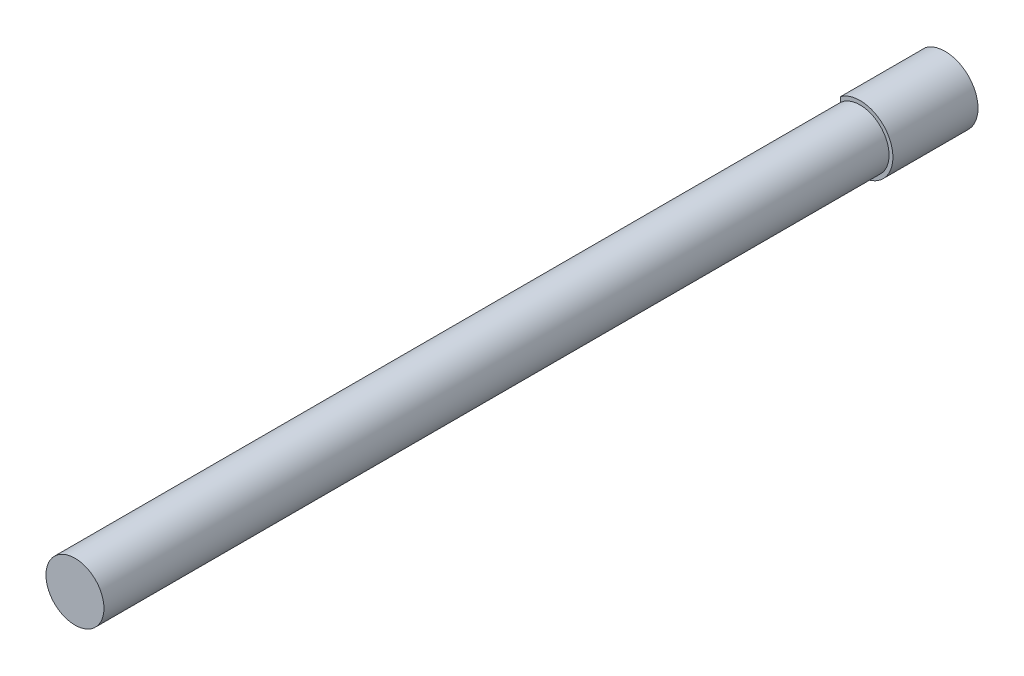
from build123d import *
from build123d.topology import SkipClean

# Parameters (mm, degrees)
BOSS_EXTRUDE1_DEPTH = 10
SKETCH2_R           = 4.25
BOSS_EXTRUDE2_DEPTH = 20
BOSS_EXTRUDE3_START = 1
BOSS_EXTRUDE3_DEPTH = 1
CUT_EXTRUDE1_START  = -20
SKETCH5_R           = 4.25
SKETCH5_R_2         = 3.75
CUT_EXTRUDE1_DEPTH  = 20
SKETCH6_R           = 3.75
BOSS_EXTRUDE4_DEPTH = 81.5


with BuildPart() as part:
    # Sketch1 → Boss-Extrude1 (new body)
    with BuildSketch(Plane.XY):
        with BuildLine():
            Line((-2.5, 3.436931771), (-2.5, -3.436931771))
            ThreePointArc((-2.5, -3.436931771), (4.25, 0), (-2.5, 3.436931771))
        make_face()
    extrude(amount=BOSS_EXTRUDE1_DEPTH)

    # Sketch2 → Boss-Extrude2 (add)
    with BuildSketch(Plane.XY.offset(10)):
        with Locations(Location((0, 0, 0), (0, 0, 126.031879072))):
            Circle(SKETCH2_R)
    extrude(amount=BOSS_EXTRUDE2_DEPTH)

    # Sketch3 → Boss-Extrude3 (add)
    with SkipClean():  # the faces are left unmerged after this step: merging them gives an invalid solid
        with BuildSketch(Plane(origin=(0, 0, 0), x_dir=(-1, 0, 0), z_dir=(0, 0, -1)).offset(BOSS_EXTRUDE3_START)):
            with BuildLine():
                Line((2.5, -3.436931771), (2.5, 3.436931771))
                ThreePointArc((2.5, 3.436931771), (-4.25, 0), (2.5, -3.436931771))
            make_face()
        extrude(amount=-BOSS_EXTRUDE3_DEPTH)

    # Sketch5 → Cut-Extrude1 (cut)
    with SkipClean():  # the faces are left unmerged after this step: merging them gives an invalid solid
        with BuildSketch(Plane.XY.offset(30).offset(CUT_EXTRUDE1_START)):
            Circle(SKETCH5_R)
            Circle(SKETCH5_R_2, mode=Mode.SUBTRACT)
        extrude(amount=CUT_EXTRUDE1_DEPTH, mode=Mode.SUBTRACT)

    # Sketch6 → Boss-Extrude4 (add)
    with SkipClean():  # the faces are left unmerged after this step: merging them gives an invalid solid
        with BuildSketch(Plane.XY.offset(30)):
            Circle(SKETCH6_R)
        extrude(amount=BOSS_EXTRUDE4_DEPTH)


solid = part.part
